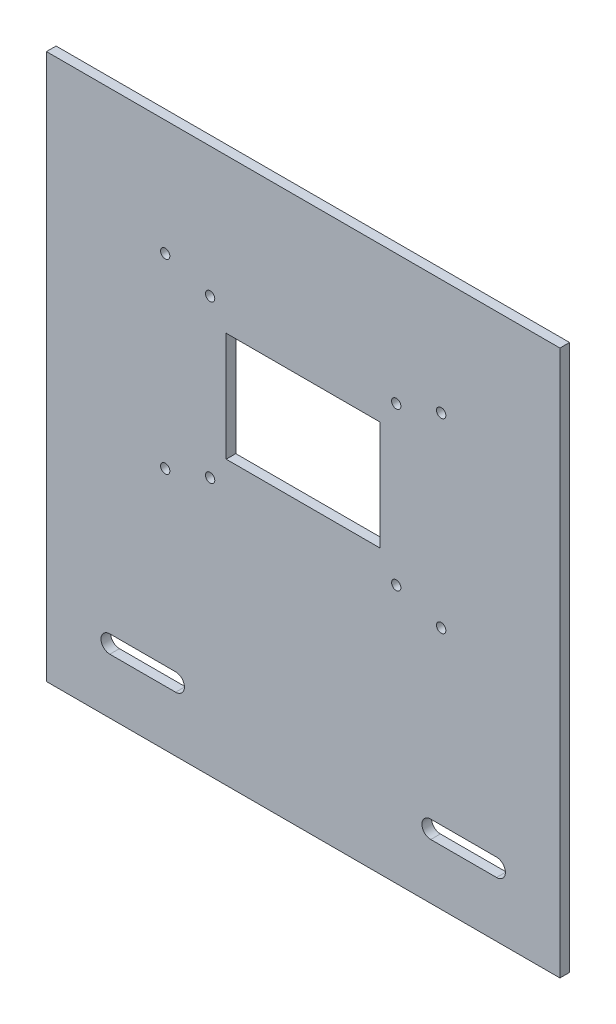
from build123d import *

# Parameters (mm, degrees)
COMPUTE_COMBO_PLATE_W   = 160
COMPUTE_COMBO_PLATE_H   = 170
COMPUTE_COMBO_PLATE_R   = 1.45
COMPUTE_COMBO_PLATE_W_2 = 48
COMPUTE_COMBO_PLATE_H_2 = 34
F_3MM_DEPTH             = 3


with BuildPart() as part:
    # 外形与孔位_compute_combo_plate → 板厚_3mm (new body)
    with BuildSketch(Plane.XY):
        with Locations((80, 85)):
            Rectangle(COMPUTE_COMBO_PLATE_W, COMPUTE_COMBO_PLATE_H)
        with Locations((51, 80.5)):
            Circle(COMPUTE_COMBO_PLATE_R, mode=Mode.SUBTRACT)
        with Locations((51, 129.5)):
            Circle(COMPUTE_COMBO_PLATE_R, mode=Mode.SUBTRACT)
        with Locations((109, 80.5)):
            Circle(COMPUTE_COMBO_PLATE_R, mode=Mode.SUBTRACT)
        with Locations((109, 129.5)):
            Circle(COMPUTE_COMBO_PLATE_R, mode=Mode.SUBTRACT)
        with Locations((37, 76)):
            Circle(COMPUTE_COMBO_PLATE_R, mode=Mode.SUBTRACT)
        with Locations((37, 134)):
            Circle(COMPUTE_COMBO_PLATE_R, mode=Mode.SUBTRACT)
        with Locations((123, 76)):
            Circle(COMPUTE_COMBO_PLATE_R, mode=Mode.SUBTRACT)
        with Locations((123, 134)):
            Circle(COMPUTE_COMBO_PLATE_R, mode=Mode.SUBTRACT)
        with Locations((80, 105)):
            Rectangle(COMPUTE_COMBO_PLATE_W_2, COMPUTE_COMBO_PLATE_H_2, mode=Mode.SUBTRACT)
        with BuildLine():
            Line((19.75, 22.75), (40.25, 22.75))
            ThreePointArc((40.25, 22.75), (43, 20), (40.25, 17.25))
            Line((40.25, 17.25), (19.75, 17.25))
            ThreePointArc((19.75, 17.25), (17, 20), (19.75, 22.75))
        make_face(mode=Mode.SUBTRACT)
        with BuildLine():
            Line((119.75, 22.75), (140.25, 22.75))
            ThreePointArc((140.25, 22.75), (143, 20), (140.25, 17.25))
            Line((140.25, 17.25), (119.75, 17.25))
            ThreePointArc((119.75, 17.25), (117, 20), (119.75, 22.75))
        make_face(mode=Mode.SUBTRACT)
    extrude(amount=F_3MM_DEPTH)


solid = part.part
